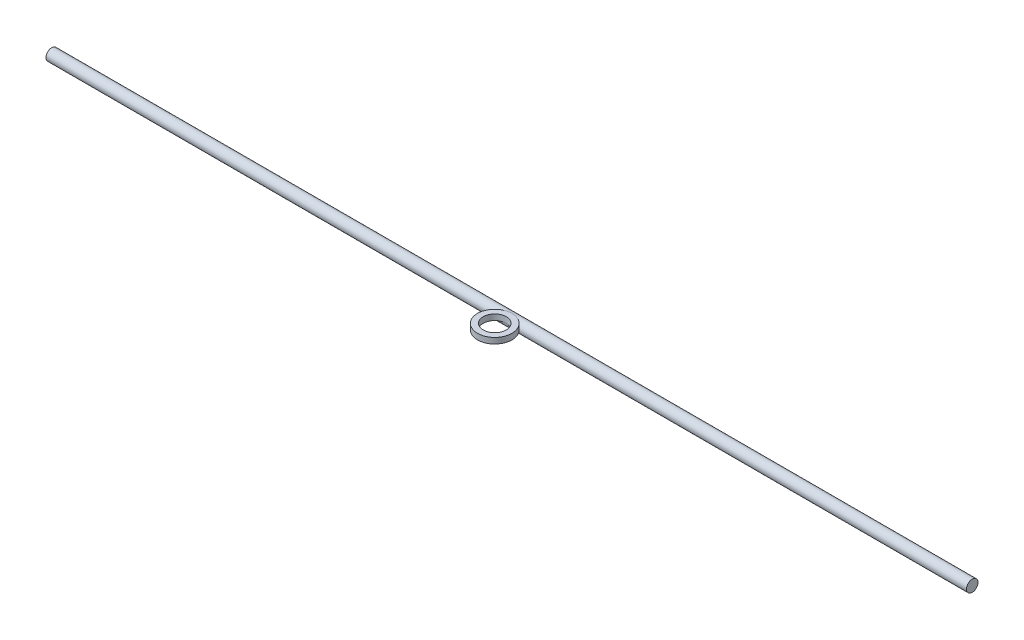
from build123d import *

# Parameters (mm, degrees)
BALAYAGE1_PROFILE_R = 5
ESQUISSE2_R         = 15
ESQUISSE2_R_2       = 10
BOSS_EXTRU_1_DEPTH  = 5


with BuildPart() as part:
    # Balayage1: sweep along a path in Esquisse1
    with BuildLine(Plane.XY) as balayage1_path:
        Line((-400, 0), (400, 0))
    # Balayage1 profile (on start of the path) → Balayage1 (sweep)
    with BuildSketch(Plane(origin=(-400, 0, 0), x_dir=(0, 0, 1), z_dir=(1, 0, 0))):
        Circle(BALAYAGE1_PROFILE_R)
    sweep(path=balayage1_path.line)

    # Esquisse2 → Boss.-Extru.1 (add)
    with BuildSketch(Plane(origin=(0, 0, 0), x_dir=(1, 0, 0), z_dir=(0, 1, 0))):
        with Locations((0, -15)):
            Circle(ESQUISSE2_R)
        with Locations(Location((0, -15, 0), (0, 0, 90))):
            Circle(ESQUISSE2_R_2, mode=Mode.SUBTRACT)
    extrude(amount=BOSS_EXTRU_1_DEPTH)


solid = part.part
